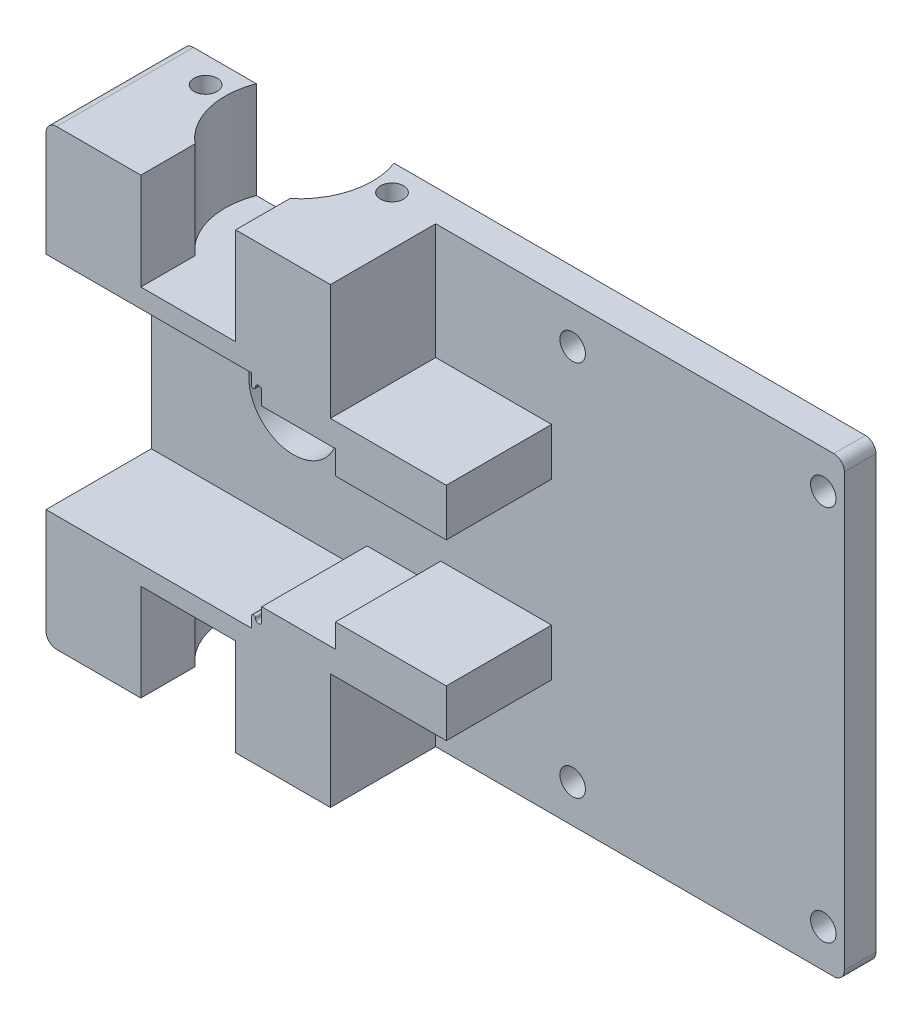
from build123d import *

# Parameters (mm, degrees)
P_IDAT_VYSUNUT_M1_DEPTH   = 6
SKICA3_R                  = 8.5
SKICA3_R_2                = 2.425
ODEBRAT_VYSUNUT_M1_DEPTH  = 6
P_IDAT_VYSUNUT_M3_DEPTH   = 20
SKICA6_R                  = 14
ODEBRAT_VYSUNUT_M2_DEPTH  = 18.4
ODEBRAT_START             = -18.4
SKICA10_R                 = 14
ODEBRAT_VYSUNUT_M3_DEPTH  = 18.4
SKICA18_W                 = 15
SKICA18_H                 = 42
P_IDAT_VYSUNUT_M5_DEPTH   = 20
ODEBRAT_VYSUNUT_M9_DEPTH  = 20
SKICA14_R                 = 2.2
ODEBRAT_VYSUNUT_M7_DEPTH  = 5
ODEBRAT_START_2           = -5
SKICA15_R                 = 2.2
ODEBRAT_VYSUNUT_M8_DEPTH  = 5
SKICA23_R                 = 2.2
ODEBRAT_VYSUNUT_M10_DEPTH = 4
SKICA24_W                 = 18
SKICA24_H                 = 10.276194705
ODEBRAT_VYSUNUT_M12_DEPTH = 18.4
SKICA31_W                 = 22
SKICA31_H                 = 42
P_IDAT_VYSUNUT_M6_DEPTH   = 20
SKICA25_W                 = 18
SKICA25_H                 = 10.276194705
ODEBRAT_VYSUNUT_M13_DEPTH = 18.4
SKICA26_W                 = 20
SKICA26_H                 = 24
ODEBRAT_VYSUNUT_M14_DEPTH = 36.4
SKICA27_W                 = 20
SKICA27_H                 = 33
ODEBRAT_VYSUNUT_M15_DEPTH = 14


with BuildPart() as part:
    # Skica2 → Přidat vysunutím1 (new body)
    with BuildSketch(Plane.XY):
        with BuildLine():
            Line((2, 0), (129.6, 0))
            ThreePointArc((129.6, 0), (131.014213562, 0.585786438), (131.6, 2))
            Line((131.6, 2), (131.6, 84))
            ThreePointArc((131.6, 84), (131.014213562, 85.414213562), (129.6, 86))
            Line((129.6, 86), (2, 86))
            ThreePointArc((2, 86), (0.585786438, 85.414213562), (0, 84))
            Line((0, 84), (0, 2))
            ThreePointArc((0, 2), (0.585786438, 0.585786438), (2, 0))
        make_face()
    extrude(amount=P_IDAT_VYSUNUT_M1_DEPTH)

    # Skica3 → Odebrat vysunutím1 (cut)
    with BuildSketch(Plane.XY.offset(6)):
        with Locations((27, 43)):
            Circle(SKICA3_R)
        with Locations((127.6, 78.8)):
            Circle(SKICA3_R_2)
        with Locations((80, 7.2)):
            Circle(SKICA3_R_2)
        with Locations((127.6, 7.2)):
            Circle(SKICA3_R_2)
        with Locations((80, 78.8)):
            Circle(SKICA3_R_2)
    extrude(amount=-ODEBRAT_VYSUNUT_M1_DEPTH, mode=Mode.SUBTRACT)

    # Skica4 → Přidat vysunutím3 (add)
    with BuildSketch(Plane.XY.offset(6)):
        with BuildLine():
            Line((2, 86), (54, 86))
            Line((54, 86), (54, 64))
            Line((54, 64), (0, 64))
            Line((0, 64), (0, 84))
            ThreePointArc((0, 84), (0.585786438, 85.414213562), (2, 86))
        make_face()
        with BuildLine():
            Line((2, 0), (54, 0))
            Line((54, 0), (54, 22))
            Line((54, 22), (0, 22))
            Line((0, 22), (0, 2))
            ThreePointArc((0, 2), (0.585786438, 0.585786438), (2, 0))
        make_face()
    extrude(amount=P_IDAT_VYSUNUT_M3_DEPTH)

    # Skica6 → Odebrat vysunutím2 (cut)
    with BuildSketch(Plane.XZ):
        with Locations((27, 5)):
            Circle(SKICA6_R)
    extrude(amount=-ODEBRAT_VYSUNUT_M2_DEPTH, mode=Mode.SUBTRACT)

    # Skica10 → Odebrat vysunutím3 (cut)
    with BuildSketch(Plane(origin=(0, 86, 0), x_dir=(1, 0, 0), z_dir=(0, 1, 0)).offset(ODEBRAT_START)):
        with Locations((27, -5)):
            Circle(SKICA10_R)
    extrude(amount=ODEBRAT_VYSUNUT_M3_DEPTH, mode=Mode.SUBTRACT)

    # Skica18 → Přidat vysunutím5 (add)
    with BuildSketch(Plane.XY.offset(6)):
        with Locations((46.5, 43)):
            Rectangle(SKICA18_W, SKICA18_H)
    extrude(amount=P_IDAT_VYSUNUT_M5_DEPTH)

    # Skica21 → Odebrat vysunutím9 (cut)
    with BuildSketch(Plane.XY.offset(26)):
        with BuildLine():
            Line((39, 24), (39, 62))
            ThreePointArc((39, 62), (39.38, 61.620000112), (39.76, 62))
            ThreePointArc((39.76, 62), (40.36, 62.599999823), (40.96, 62))
            Line((40.96, 62), (40.96, 24))
            ThreePointArc((40.96, 24), (40.36, 23.4), (39.76, 24))
            ThreePointArc((39.76, 24), (39.38, 24.38), (39, 24))
        make_face()
    extrude(amount=-ODEBRAT_VYSUNUT_M9_DEPTH, mode=Mode.SUBTRACT)

    # Skica14 → Odebrat vysunutím7 (cut)
    with BuildSketch(Plane.XZ):
        with Locations(Location((9.3, 5, 0), (0, 0, 270))):
            Circle(SKICA14_R)
        with Locations(Location((44.7, 5, 0), (0, 0, 270))):
            Circle(SKICA14_R)
    extrude(amount=-ODEBRAT_VYSUNUT_M7_DEPTH, mode=Mode.SUBTRACT)

    # Skica15 → Odebrat vysunutím8 (cut)
    with BuildSketch(Plane(origin=(0, 86, 0), x_dir=(1, 0, 0), z_dir=(0, 1, 0)).offset(ODEBRAT_START_2)):
        with Locations(Location((9.3, -5, 0), (0, 0, 90))):
            Circle(SKICA15_R)
        with Locations(Location((44.7, -5, 0), (0, 0, 90))):
            Circle(SKICA15_R)
    extrude(amount=ODEBRAT_VYSUNUT_M8_DEPTH, mode=Mode.SUBTRACT)

    # Skica23 → Odebrat vysunutím10 (cut)
    with BuildSketch(Plane(origin=(0, 0, 0), x_dir=(-1, 0, 0), z_dir=(0, 0, -1))):
        with Locations((-118.8, 55.2)):
            Circle(SKICA23_R)
        with Locations((-88.8, 55.2)):
            Circle(SKICA23_R)
        with Locations((-88.8, 30.8)):
            Circle(SKICA23_R)
        with Locations((-118.8, 30.8)):
            Circle(SKICA23_R)
    extrude(amount=-ODEBRAT_VYSUNUT_M10_DEPTH, mode=Mode.SUBTRACT)

    # Skica24 → Odebrat vysunutím12 (cut)
    with BuildSketch(Plane(origin=(0, 86, 0), x_dir=(1, 0, 0), z_dir=(0, 1, 0))):
        with Locations((27, -20.861902648)):
            Rectangle(SKICA24_W, SKICA24_H)
    extrude(amount=-ODEBRAT_VYSUNUT_M12_DEPTH, mode=Mode.SUBTRACT)

    # Skica31 → Přidat vysunutím6 (add)
    with BuildSketch(Plane.XY.offset(6)):
        with Locations((65, 43)):
            Rectangle(SKICA31_W, SKICA31_H)
    extrude(amount=P_IDAT_VYSUNUT_M6_DEPTH)

    # Skica25 → Odebrat vysunutím13 (cut)
    with BuildSketch(Plane.XZ):
        with Locations((27, 20.861902648)):
            Rectangle(SKICA25_W, SKICA25_H)
    extrude(amount=-ODEBRAT_VYSUNUT_M13_DEPTH, mode=Mode.SUBTRACT)

    # Skica26 → Odebrat vysunutím14 (cut)
    with BuildSketch(Plane.ZY.offset(-40.96)):
        with Locations((16, 43)):
            Rectangle(SKICA26_W, SKICA26_H)
    extrude(amount=-ODEBRAT_VYSUNUT_M14_DEPTH, mode=Mode.SUBTRACT)

    # Skica27 → Odebrat vysunutím15 (cut)
    with BuildSketch(Plane.ZY.offset(-40.96)):
        with Locations((16, 43)):
            Rectangle(SKICA27_W, SKICA27_H)
    extrude(amount=-ODEBRAT_VYSUNUT_M15_DEPTH, mode=Mode.SUBTRACT)


solid = part.part
